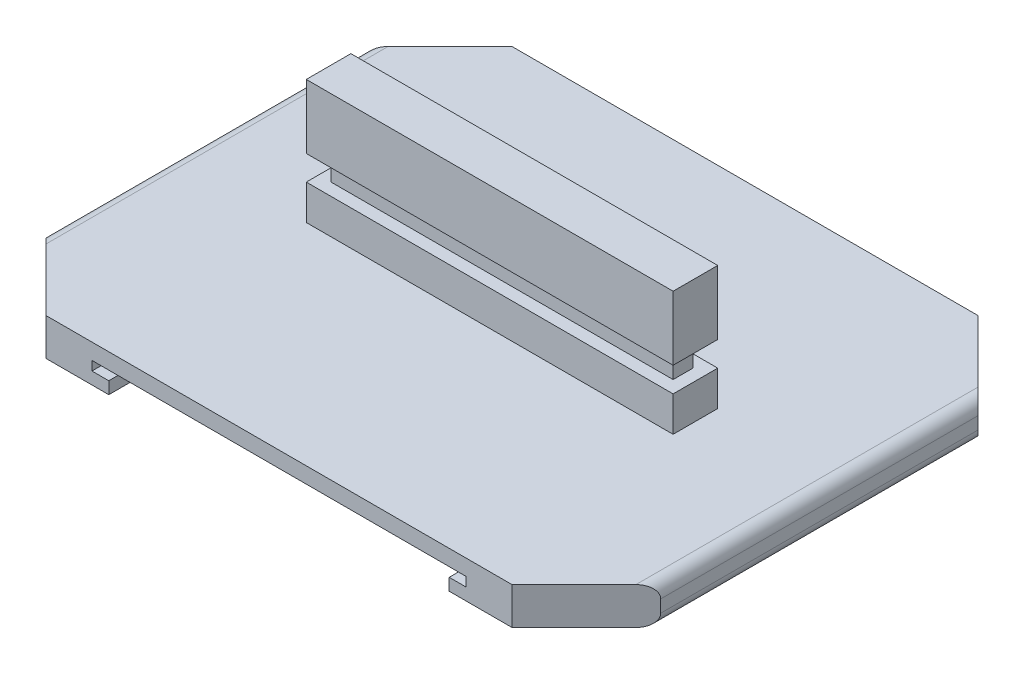
from build123d import *

# Parameters (mm, degrees)
EXTRUDE_1_DEPTH          = 1.5
SKETCH_2_W               = 14.8
SKETCH_2_H               = 1.8
EXTRUDE_2_DEPTH          = 5
SKETCH_5_W               = 0.478908464
SKETCH_5_H               = 0.127427029
CUT_EXTRUDE_1_DEPTH      = 0.1
CUT_EXTRUDE_2_DEPTH      = 0.5
CUT_EXTRUDE_2_DEPTH_BACK = 0.5
SKETCH_4_W               = 15.629806388
SKETCH_4_H               = 2.571592952
SKETCH_4_W_2             = 13.8
SKETCH_4_H_2             = 0.8
CUT_EXTRUDE_3_DEPTH      = 117.5
CUT_EXTRUDE_4_DEPTH      = 19.5


with BuildPart() as part:
    # 草图1 → 凸台-拉伸1 (new body)
    with BuildSketch(Plane(origin=(0, 0, 0), x_dir=(1, 0, 0), z_dir=(0, 1, 0))):
        Polygon((-12.4, 6.4), (-9.4, 9.4), (9.4, 9.4), (12.4, 6.4), (12.4, -6.4), (9.4, -9.4), (-9.4, -9.4), (-12.4, -6.4), align=None)
    extrude(amount=EXTRUDE_1_DEPTH)

    # 草图2 → 凸台-拉伸2 (add)
    with BuildSketch(Plane(origin=(0, 1.5, 0), x_dir=(1, 0, 0), z_dir=(0, 1, 0))):
        Rectangle(SKETCH_2_W, SKETCH_2_H)
    extrude(amount=EXTRUDE_2_DEPTH)

    # 草图5 → 切除-拉伸1 (cut)
    with BuildSketch(Plane.XY.offset(0.9)):
        with Locations((-7.4, 3.476334332)):
            Rectangle(SKETCH_5_W, SKETCH_5_H)
    extrude(amount=-CUT_EXTRUDE_1_DEPTH, mode=Mode.SUBTRACT)

    # 草图4 → 切除-拉伸2 (cut, two sides: drawn at the far end of the back side and taken through both)
    with BuildSketch(Plane(origin=(0, 3.412620817, 0), x_dir=(1, 0, 0), z_dir=(0, 1, 0)).offset(-CUT_EXTRUDE_2_DEPTH_BACK)):
        Rectangle(SKETCH_4_W, SKETCH_4_H)
        Rectangle(SKETCH_4_W_2, SKETCH_4_H_2, mode=Mode.SUBTRACT)
    extrude(amount=CUT_EXTRUDE_2_DEPTH + CUT_EXTRUDE_2_DEPTH_BACK, mode=Mode.SUBTRACT)

    # 草图6 → 切除-拉伸3 (cut)
    with BuildSketch(Plane.XY.offset(9.4)):
        Polygon((-6.867040084, 0.488052507), (-6.867040084, 0), (0, 0), (0, 0.859235203), (-7.547096834, 0.859235203), (-7.547096834, 0.488052507), align=None)
        Polygon((0, 0.859235203), (0, 0), (6.867040084, 0), (6.867040084, 0.488052507), (7.547096834, 0.488052507), (7.547096834, 0.859235203), align=None)
    extrude(amount=-CUT_EXTRUDE_3_DEPTH, mode=Mode.SUBTRACT)

    # 草图9 → 切除-拉伸4 (cut)
    with BuildSketch(Plane.XY.offset(9.4)):
        with BuildLine():
            Line((-9.4, 0), (-11.9, 0))
            ThreePointArc((-11.9, 0), (-12.253553391, 0.146446609), (-12.4, 0.5))
            Line((-12.4, 0.5), (-12.4, 1))
            ThreePointArc((-12.4, 1), (-12.253553391, 1.353553391), (-11.9, 1.5))
            Line((-11.9, 1.5), (-13.659182298, 1.5))
            Line((-13.659182298, 1.5), (-13.659182298, -1.631891655))
            Line((-13.659182298, -1.631891655), (14.456410837, -1.631891655))
            Line((14.456410837, -1.631891655), (14.456410837, 1.5))
            Line((14.456410837, 1.5), (11.9, 1.5))
            ThreePointArc((11.9, 1.5), (12.253553391, 1.353553391), (12.4, 1))
            Line((12.4, 1), (12.4, 0.5))
            ThreePointArc((12.4, 0.5), (12.253553391, 0.146446609), (11.9, 0))
            Line((11.9, 0), (9.4, 0))
            Line((9.4, 0), (6.867040084, 0))
            Line((6.867040084, 0), (-6.867040084, 0))
            Line((-6.867040084, 0), (-9.4, 0))
        make_face()
    extrude(amount=-CUT_EXTRUDE_4_DEPTH, mode=Mode.SUBTRACT)


solid = part.part
